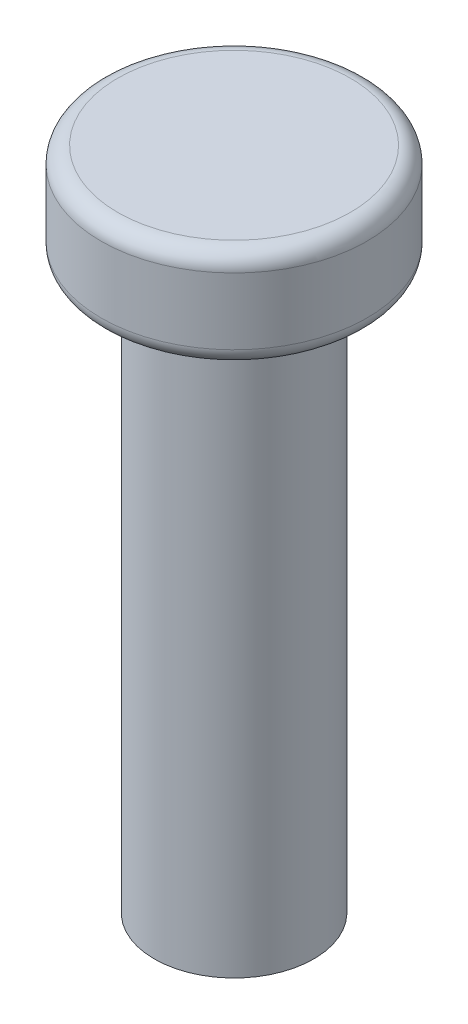
from build123d import *

# Parameters (mm, degrees)
SKETCH1_R           = 2.4
BOSS_EXTRUDE1_DEPTH = 17
SKETCH2_R           = 4
BOSS_EXTRUDE2_DEPTH = 3
FILLET5_R           = 0.5


with BuildPart() as part:
    # Sketch1 → Boss-Extrude1 (new body)
    with BuildSketch(Plane(origin=(0, 0, 0), x_dir=(1, 0, 0), z_dir=(0, 1, 0))):
        with Locations(Location((0, 0, 0), (0, 0, 270))):
            Circle(SKETCH1_R)
    extrude(amount=BOSS_EXTRUDE1_DEPTH)

    # Sketch2 → Boss-Extrude2 (add)
    with BuildSketch(Plane(origin=(0, 17, 0), x_dir=(1, 0, 0), z_dir=(0, 1, 0))):
        with Locations(Location((0, 0, 0), (0, 0, 270))):
            Circle(SKETCH2_R)
    extrude(amount=BOSS_EXTRUDE2_DEPTH)

    # Fillet5
    fillet5_edges = [part.edges().sort_by_distance(p)[0] for p in [
        (0, 17, -4),
        (0, 20, -4),
    ]]
    fillet(fillet5_edges, radius=FILLET5_R)


solid = part.part
